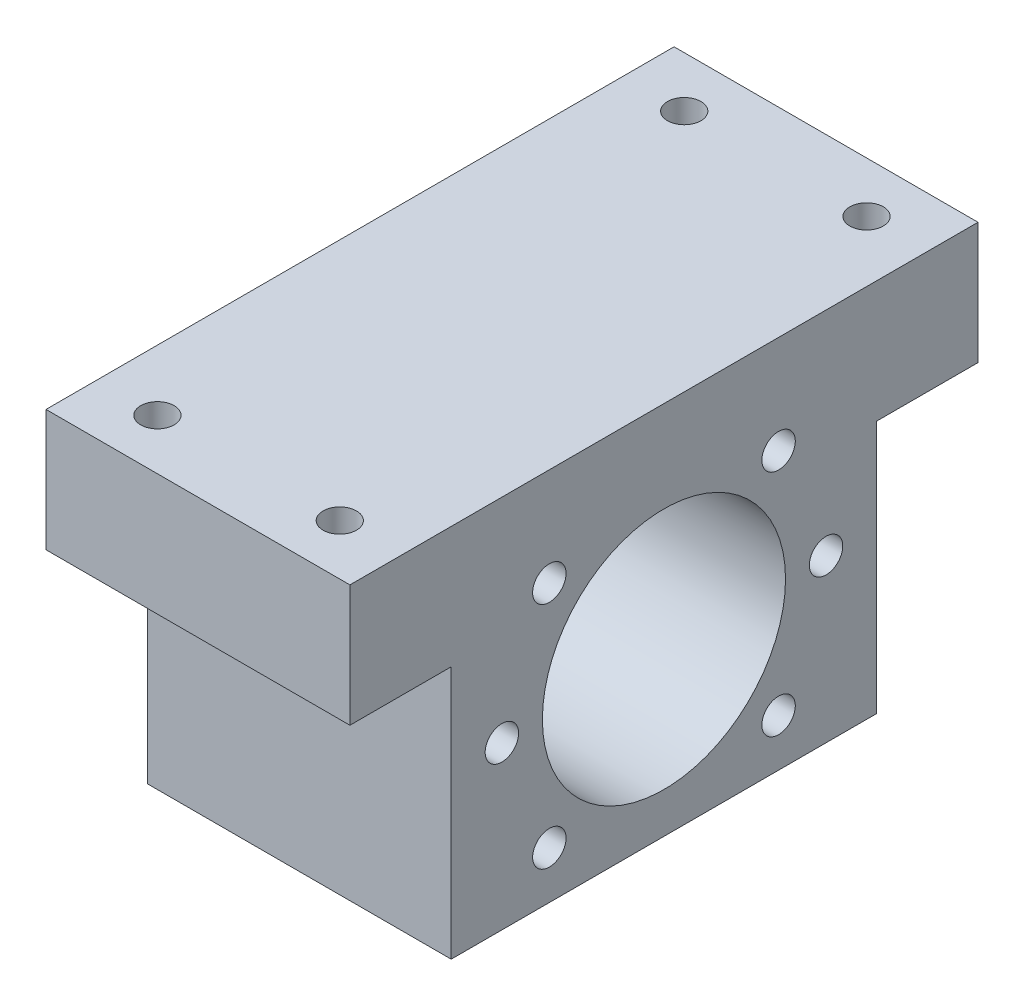
from build123d import *

# Parameters (mm, degrees)
SKETCH_2_W          = 62
SKETCH_2_H          = 82
EXTRUDE_2_DEPTH     = 30
SKETCH_3_R          = 12
CUT_EXTRUDE_1_DEPTH = 60.514704065
CUT_EXTRUDE_2_DEPTH = 60.514704065
HOLE_WIZARD_M4_1_D  = 3.3
HOLE_WIZARD_M4_2_D  = 3.3


with BuildPart() as part:
    # 草图2 → 凸台-拉伸2 (new body)
    with BuildSketch(Plane(origin=(0, 0, 0), x_dir=(0, 0, -1), z_dir=(1, 0, 0))):
        Rectangle(SKETCH_2_W, SKETCH_2_H)
    extrude(amount=EXTRUDE_2_DEPTH)

    # 草图3 → 切除-拉伸1 (cut, through all)
    with BuildSketch(Plane.ZY):
        with Locations((0, 20)):
            Circle(SKETCH_3_R)
    extrude(amount=-CUT_EXTRUDE_1_DEPTH, mode=Mode.SUBTRACT)

    # 草图7 → 切除-拉伸2 (cut, through all)
    with BuildSketch(Plane(origin=(30, 0, 0), x_dir=(0, 0, -1), z_dir=(1, 0, 0))):
        Polygon((-31, 29), (-21, 29), (-21, 4), (21, 4), (21, 29), (31, 29), (31, -41), (-31, -41), align=None)
    extrude(amount=-CUT_EXTRUDE_2_DEPTH, mode=Mode.SUBTRACT)

    # M4 螺纹孔1 (through all)
    with Locations(Plane.ZY):
        with Locations((-11.313708499, 31.313708499), (11.313708499, 8.686291501), (11.313708499, 31.313708499), (16, 20), (-11.313708499, 8.686291501), (-16, 20)):
            Hole(HOLE_WIZARD_M4_1_D / 2)

    # M4 螺纹孔2 (through all)
    with Locations(Plane(origin=(0, 29, 0), x_dir=(-1, 0, 0), z_dir=(0, -1, 0))):
        with Locations((-6, 26), (-24, 26), (-6, -26), (-24, -26)):
            Hole(HOLE_WIZARD_M4_2_D / 2)


solid = part.part
